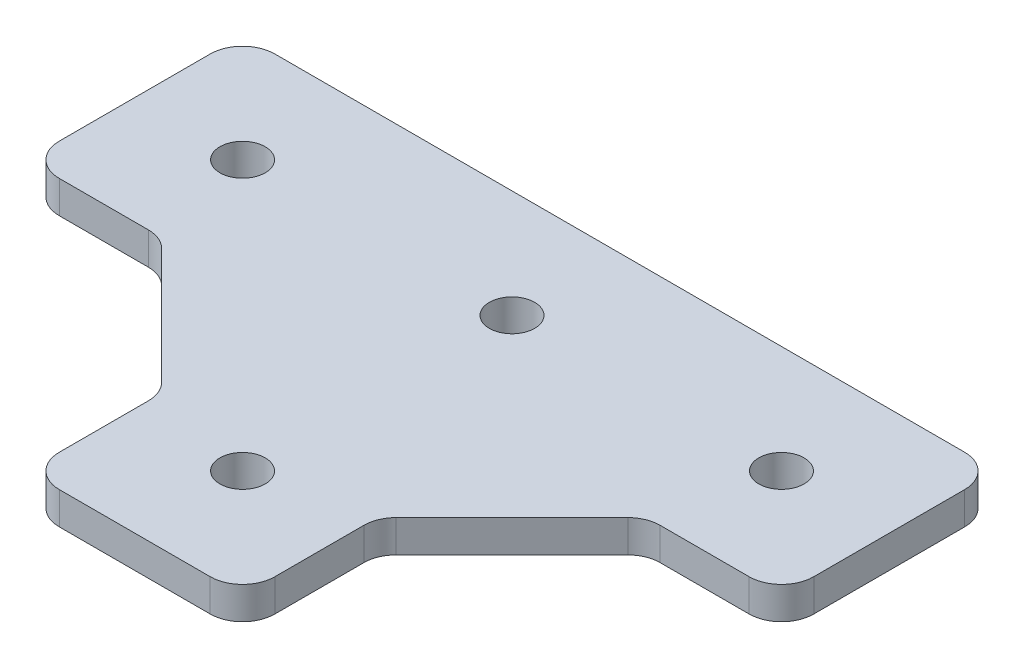
from build123d import *

# Parameters (mm, degrees)
SKETCH_1_R      = 2.1
EXTRUDE_1_DEPTH = 3
FILLET_1_R      = 3


with BuildPart() as part:
    # 草图1 → 凸台-拉伸1 (new body)
    # profile 1 of 3: a face of its own
    with BuildSketch(Plane(origin=(0, 0, 0), x_dir=(1, 0, 0), z_dir=(0, 1, 0))):
        Polygon((35, -10), (35, 10), (-35, 10), (-35, -10), (-22.5, -10), (-10, -10), (-10, -22.5), (-10, -35), (10, -35), (10, -22.5), (10, -10), (22.5, -10), align=None)
        with Locations(Location((0, -25, 0), (0, 0, 270))):
            Circle(SKETCH_1_R, mode=Mode.SUBTRACT)
        with Locations(Location((-25, 0, 0), (0, 0, 270))):
            Circle(SKETCH_1_R, mode=Mode.SUBTRACT)
        with Locations(Location((0, 0, 0), (0, 0, 270))):
            Circle(SKETCH_1_R, mode=Mode.SUBTRACT)
        with Locations(Location((25, 0, 0), (0, 0, 270))):
            Circle(SKETCH_1_R, mode=Mode.SUBTRACT)
    # profile 2 of 3: a face of its own
    with BuildSketch(Plane(origin=(0, 0, 0), x_dir=(1, 0, 0), z_dir=(0, 1, 0))):
        Polygon((-10, -10), (-22.5, -10), (-10, -22.5), align=None)
    # profile 3 of 3: a face of its own
    with BuildSketch(Plane(origin=(0, 0, 0), x_dir=(1, 0, 0), z_dir=(0, 1, 0))):
        Polygon((10, -22.5), (22.5, -10), (10, -10), align=None)
    extrude(amount=EXTRUDE_1_DEPTH)

    # 圆角1
    fillet_1_edges = [part.edges().sort_by_distance(p)[0] for p in [
        (10, 1.5, 22.5),
        (10, 1.5, 35),
        (-10, 1.5, 35),
        (-10, 1.5, 22.5),
        (-22.5, 1.5, 10),
        (-35, 1.5, 10),
        (-35, 1.5, -10),
        (35, 1.5, -10),
        (35, 1.5, 10),
        (22.5, 1.5, 10),
    ]]
    fillet(fillet_1_edges, radius=FILLET_1_R)


solid = part.part
